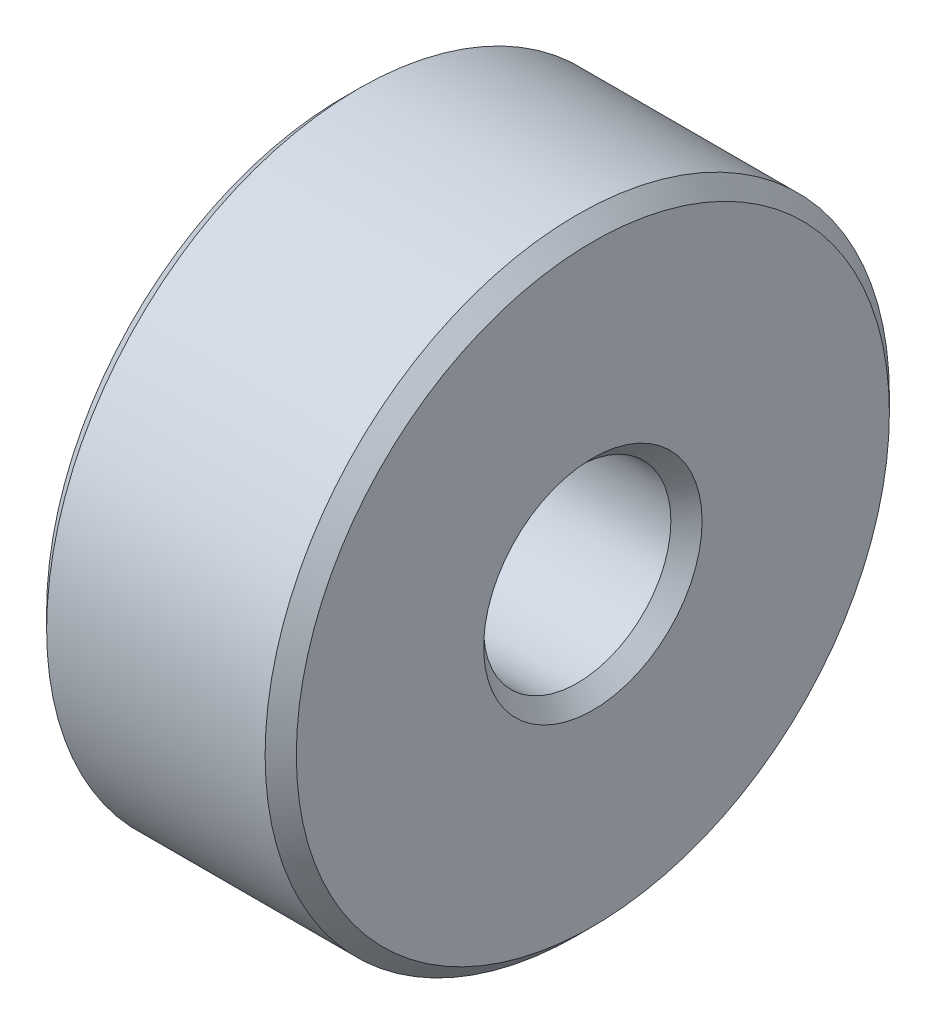
from build123d import *

# Parameters (mm, degrees)
SKETCH1_R           = 5
SKETCH1_R_2         = 1.5
BOSS_EXTRUDE1_DEPTH = 2
CHAMFER1_SIZE       = 0.25


with BuildPart() as part:
    # Sketch1 → Boss-Extrude1 (new, symmetric)
    with BuildSketch(Plane(origin=(0, 0, 0), x_dir=(0, 0, -1), z_dir=(1, 0, 0))):
        Circle(SKETCH1_R)
        Circle(SKETCH1_R_2, mode=Mode.SUBTRACT)
    extrude(amount=BOSS_EXTRUDE1_DEPTH, both=True)

    # Chamfer1
    chamfer1_edges = [part.edges().sort_by_distance(p)[0] for p in [
        (-2, 0, 5),
        (2, 0, 5),
        (2, 0, 1.5),
    ]]
    chamfer(chamfer1_edges, length=CHAMFER1_SIZE)


solid = part.part
